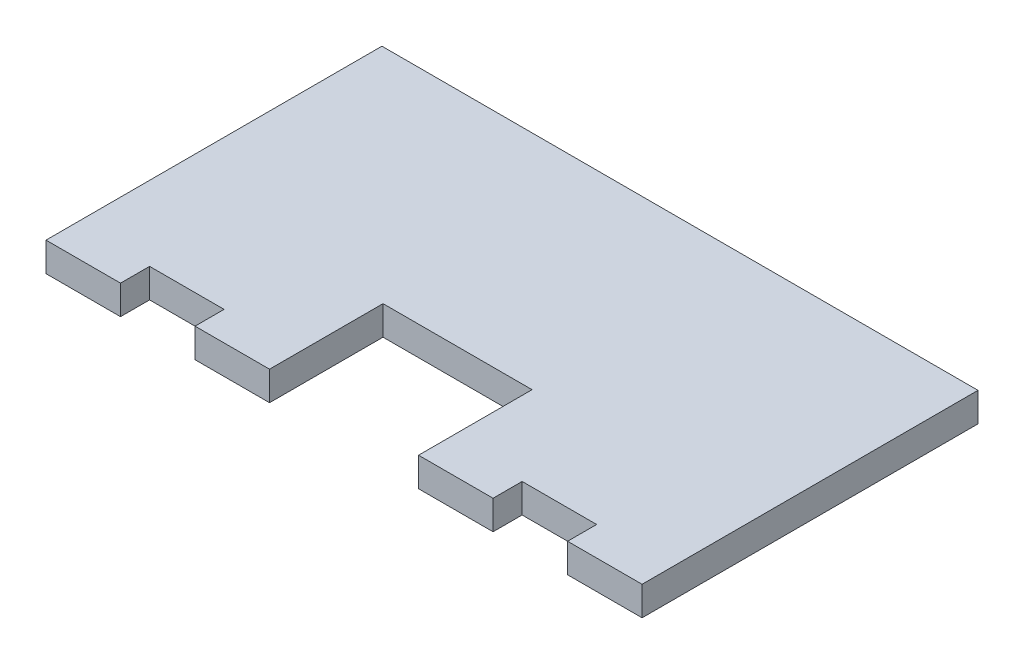
from build123d import *

# Parameters (mm, degrees)
SKETCH1_W           = 147.9296
SKETCH1_H           = 83.3628
BOSS_EXTRUDE1_DEPTH = 7.2136
SKETCH2_W           = 18.4912
SKETCH2_H           = 7.2136
SKETCH2_H_2         = 28.1686
CUT_EXTRUDE1_DEPTH  = 109.439566659


with BuildPart() as part:
    # Sketch1 → Boss-Extrude1 (new body)
    with BuildSketch(Plane(origin=(0, 0, 0), x_dir=(1, 0, 0), z_dir=(0, 1, 0))):
        with Locations((25.250223474, 1.486675117)):
            Rectangle(SKETCH1_W, SKETCH1_H)
    extrude(amount=BOSS_EXTRUDE1_DEPTH)

    # Sketch2 → Cut-Extrude1 (cut, through all)
    with BuildSketch(Plane.XZ):
        with Locations((-20.977776526, 36.587924883)):
            Rectangle(SKETCH2_W, SKETCH2_H)
        with Locations((16.004623474, 26.110424883)):
            Rectangle(SKETCH2_W, SKETCH2_H_2)
        with Locations((34.495823474, 26.110424883)):
            Rectangle(SKETCH2_W, SKETCH2_H_2)
        with Locations((71.478223474, 36.587924883)):
            Rectangle(SKETCH2_W, SKETCH2_H)
    extrude(amount=-CUT_EXTRUDE1_DEPTH, mode=Mode.SUBTRACT)


solid = part.part
